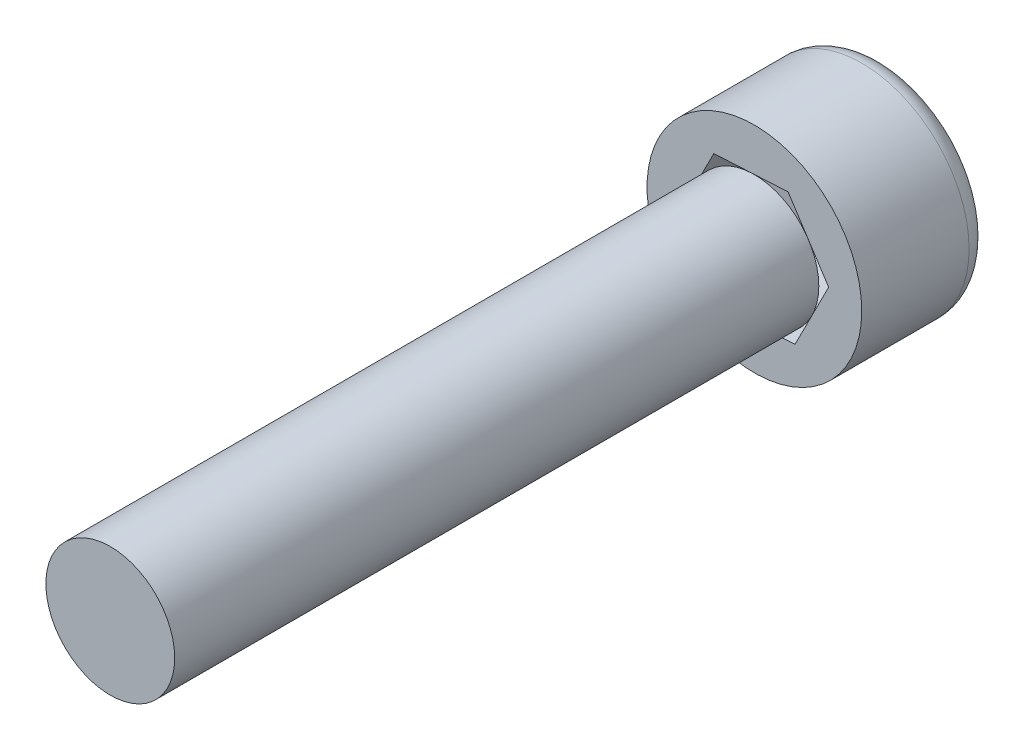
from build123d import *

# Parameters (mm, degrees)
SKETCH1_R           = 2.5
BOSS_EXTRUDE1_DEPTH = 3
SKETCH2_R           = 1.5
BOSS_EXTRUDE2_DEPTH = 15
CUT_EXTRUDE1_DEPTH  = 3
FILLET1_R           = 0.5


with BuildPart() as part:
    # Sketch1 → Boss-Extrude1 (new body)
    with BuildSketch(Plane.XY):
        Circle(SKETCH1_R)
    extrude(amount=BOSS_EXTRUDE1_DEPTH)

    # Sketch2 → Boss-Extrude2 (add)
    with BuildSketch(Plane.XY.offset(3)):
        Circle(SKETCH2_R)
    extrude(amount=BOSS_EXTRUDE2_DEPTH)

    # Sketch3 → Cut-Extrude1 (cut)
    with BuildSketch(Plane(origin=(0, 0, 0), x_dir=(-1, 0, 0), z_dir=(0, 0, -1))):
        Polygon((0.784462107, -1.544221229), (1.729565866, -0.092746502), (0.94510376, 1.451474727), (-0.784462107, 1.544221229), (-1.729565866, 0.092746502), (-0.94510376, -1.451474727), align=None)
    extrude(amount=-CUT_EXTRUDE1_DEPTH, mode=Mode.SUBTRACT)


with BuildPart() as cut_extrude1_piece_1:
    # of the separate pieces the step leaves, piece 1, a body of its own (cut_extrude1_pieces)
    add(part.part.solids().sort_by_distance((1.5, 0, 3))[0])


with BuildPart() as cut_extrude1_piece_2:
    # of the separate pieces the step leaves, piece 2, a body of its own (cut_extrude1_pieces)
    add(part.part.solids().sort_by_distance((2.5, 0, 0))[0])

    # Fillet1
    fillet1_edges = [cut_extrude1_piece_2.edges().sort_by_distance(p)[0] for p in [
        (-2.5, 0, 0),
    ]]
    fillet(fillet1_edges, radius=FILLET1_R)


solid = Compound([cut_extrude1_piece_1.part, cut_extrude1_piece_2.part])
